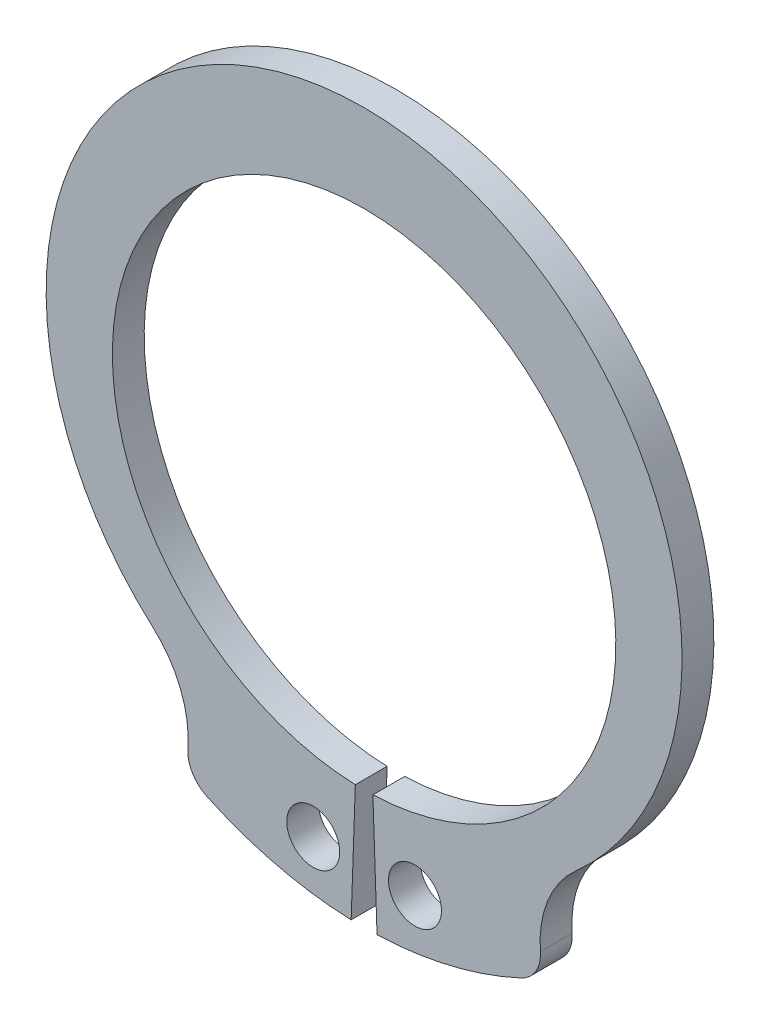
from build123d import *

# Parameters (mm, degrees)
SKETCH3_R           = 1.25
BOSS_EXTRUDE1_DEPTH = 1.2


with BuildPart() as part:
    # Sketch3 → Boss-Extrude1 (new body)
    with BuildSketch(Plane.XY):
        with BuildLine():
            ThreePointArc((9.5, 0), (6.833728103, -6.599254519), (0.331545219, -9.494212857))
            Line((0.331545219, -9.494212857), (0.390890237, -11.193631845))
            ThreePointArc((0.390890237, -11.193631845), (0.917194081, -11.164896783), (1.441728369, -11.113077659))
            ThreePointArc((1.441728369, -11.113077659), (1.771253828, -11.002545946), (2.118708081, -11.011480689))
            ThreePointArc((2.118708081, -11.011480689), (5.247002618, -9.99207874), (7.980846189, -8.161366754))
            ThreePointArc((7.980846189, -8.161366754), (10.949204407, -4.110694744), (12, 0.8))
            ThreePointArc((12, 0.8), (-4.910694694, 11.749204429), (-7.980846271, -8.161366682))
            ThreePointArc((-7.980846271, -8.161366682), (-5.247002667, -9.992078716), (-2.118708081, -11.011480689))
            ThreePointArc((-2.118708081, -11.011480689), (-1.771253828, -11.002545946), (-1.441728369, -11.113077659))
            ThreePointArc((-1.441728369, -11.113077659), (-0.917194081, -11.164896783), (-0.390890237, -11.193631845))
            Line((-0.390890237, -11.193631845), (-0.331545219, -9.494212857))
            ThreePointArc((-0.331545219, -9.494212857), (-6.599254519, 6.833728103), (9.5, 0))
        make_face()
        with BuildLine():
            Line((-0.488592954, -13.991471578), (-0.390890237, -11.193631845))
            ThreePointArc((-0.390890237, -11.193631845), (-0.917194081, -11.164896783), (-1.441728369, -11.113077659))
            ThreePointArc((-1.441728369, -11.113077659), (-1.060032855, -11.480559337), (-0.919665731, -11.991471578))
            ThreePointArc((-0.919665731, -11.991471578), (-2.552499695, -12.765759106), (-2.118708081, -11.011480689))
            ThreePointArc((-2.118708081, -11.011480689), (-5.247002667, -9.992078716), (-7.980846271, -8.161366682))
            ThreePointArc((-7.980846271, -8.161366682), (-6.991393703, -9.511590619), (-6.64112857, -11.148488723))
            ThreePointArc((-6.64112857, -11.148488723), (-6.6440156, -11.300435779), (-6.652672524, -11.452163497))
            ThreePointArc((-6.652672524, -11.452163497), (-5.358796576, -10.297964009), (-4.156280005, -11.547061813))
            ThreePointArc((-4.156280005, -11.547061813), (-4.735472335, -12.601821059), (-5.936307315, -12.679126762))
            ThreePointArc((-5.936307315, -12.679126762), (-3.278779971, -13.610642964), (-0.488592954, -13.991471578))
        make_face()
        with Locations((-5.406280005, -11.547061813)):
            Circle(SKETCH3_R)
        with BuildLine():
            ThreePointArc((1.441728369, -11.113077659), (0.917194081, -11.164896783), (0.390890237, -11.193631845))
            Line((0.390890237, -11.193631845), (0.488592954, -13.991471578))
            ThreePointArc((0.488592954, -13.991471578), (3.278779951, -13.610642969), (5.936307279, -12.67912678))
            ThreePointArc((5.936307279, -12.67912678), (4.326800249, -10.916805153), (6.652672524, -11.452163497))
            ThreePointArc((6.652672524, -11.452163497), (6.931847444, -9.65141373), (7.980846189, -8.161366754))
            ThreePointArc((7.980846189, -8.161366754), (5.247002618, -9.99207874), (2.118708081, -11.011480689))
            ThreePointArc((2.118708081, -11.011480689), (2.693953259, -11.358637615), (2.919665731, -11.991471578))
            ThreePointArc((2.919665731, -11.991471578), (1.40875349, -12.851104454), (1.441728369, -11.113077659))
        make_face()
        with Locations((5.406280005, -11.547061813)):
            Circle(SKETCH3_R)
    extrude(amount=BOSS_EXTRUDE1_DEPTH)


solid = part.part
